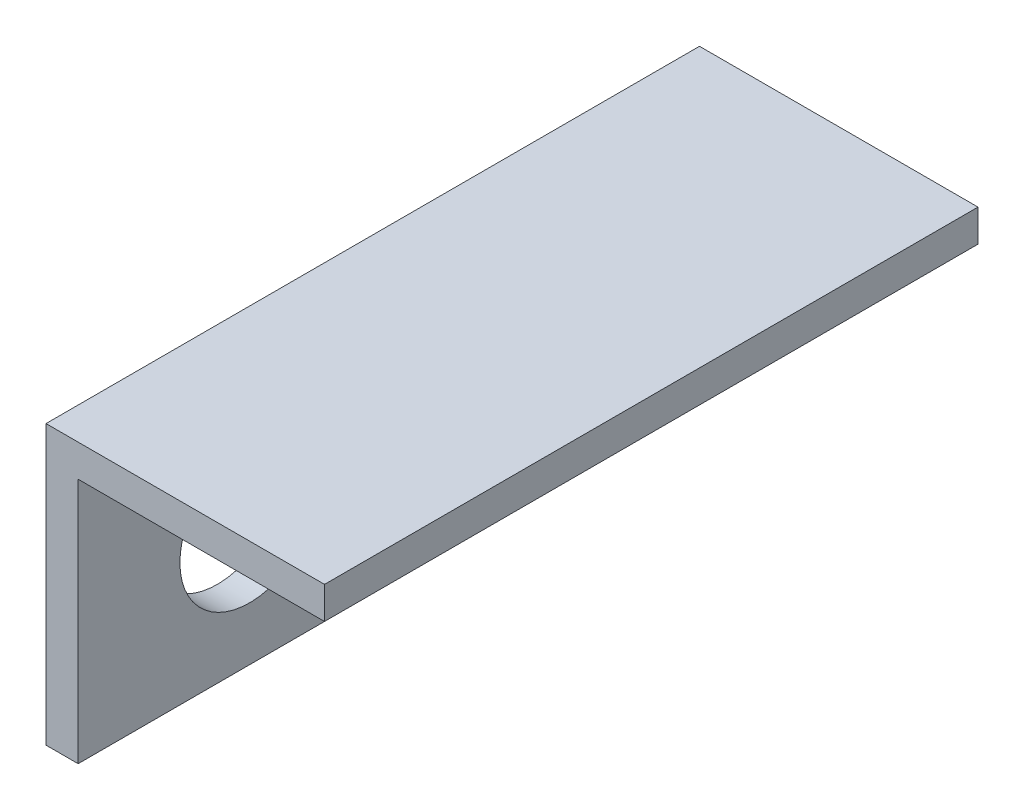
from build123d import *

# Parameters (mm, degrees)
SKETCH1_W           = 61
SKETCH1_H           = 26
BOSS_EXTRUDE1_DEPTH = 3
SKETCH3_W           = 61
SKETCH3_H           = 3
BOSS_EXTRUDE2_DEPTH = 26
SKETCH4_R           = 2.5
SKETCH4_R_2         = 6.5
CUT_EXTRUDE1_DEPTH  = 43.133715716
CUT_EXTRUDE2_DEPTH  = 0.5
CUT_EXTRUDE3_DEPTH  = 0.5
CUT_EXTRUDE4_DEPTH  = 0.5


with BuildPart() as part:
    # Sketch1 → Boss-Extrude1 (new body)
    with BuildSketch(Plane(origin=(0, 0, 0), x_dir=(0, 0, -1), z_dir=(1, 0, 0))):
        Rectangle(SKETCH1_W, SKETCH1_H)
    extrude(amount=BOSS_EXTRUDE1_DEPTH)

    # Sketch3 → Boss-Extrude2 (add)
    with BuildSketch(Plane(origin=(0, 0, 0), x_dir=(0, 0, -1), z_dir=(1, 0, 0))):
        with Locations((0, 11.5)):
            Rectangle(SKETCH3_W, SKETCH3_H)
    extrude(amount=BOSS_EXTRUDE2_DEPTH)

    # Sketch4 → Cut-Extrude1 (cut, through all)
    with BuildSketch(Plane(origin=(0, 0, 0), x_dir=(0, 0, -1), z_dir=(1, 0, 0))):
        with Locations(Location((10.5, -1.5, 0), (0, 0, 180))):
            Circle(SKETCH4_R)
        with Locations(Location((-14.5, -1.5, 0), (0, 0, 180))):
            Circle(SKETCH4_R_2)
    extrude(amount=CUT_EXTRUDE1_DEPTH, mode=Mode.SUBTRACT)

    # Sketch5 → Cut-Extrude2 (cut)
    # profile 1 of 11: a face of its own
    with BuildSketch(Plane.ZY):
        with BuildLine():
            Line((-26.754038151, 6.735917857), (-26.071145523, 6.735917857))
            add(Edge.make_bspline(
                [(-26.071145523, 6.735917857), (-26.037717045, 6.735742107), (-25.972924334, 6.735401459), (-25.878704892, 6.730118328), (-25.790456082, 6.722914658), (-25.70815231, 6.711484565), (-25.631831607, 6.697692788), (-25.56126397, 6.680990972), (-25.496673798, 6.660964358), (-25.419561061, 6.629118077), (-25.3316404, 6.581794909), (-25.236442008, 6.511866344), (-25.155037768, 6.426333881), (-25.084851451, 6.329851225), (-25.029050331, 6.223715453), (-24.988681034, 6.110456265), (-24.963123159, 5.991534523), (-24.960494725, 5.909891345), (-24.959166356, 5.868630197)],
                knots=[0, 0, 0, 0, 1.001505555, 1.941167018, 2.826882275, 3.653841531, 4.429895133, 5.150066043, 5.825578002, 6.45369114, 7.647487171, 8.808567382, 9.977351308, 11.170798116, 12.373658725, 13.556498008, 14.765093433, 16, 16, 16, 16], degree=3))
            add(Edge.make_bspline(
                [(-24.959166356, 5.868630197), (-24.960259575, 5.829977641), (-24.962407852, 5.754021724), (-24.982950611, 5.642927615), (-25.01511128, 5.537176396), (-25.059816529, 5.437154011), (-25.117918525, 5.345120398), (-25.186776844, 5.260333132), (-25.269853646, 5.186382075), (-25.332096886, 5.145039172), (-25.363713632, 5.124038851)],
                knots=[0, 0, 0, 0, 1.044552857, 2.05264487, 3.044412934, 4.028983338, 5.005914585, 5.980388656, 6.974128949, 8, 8, 8, 8], degree=3))
            add(Edge.make_bspline(
                [(-25.363713632, 5.124038851), (-25.323953204, 5.108773852), (-25.247881657, 5.079568128), (-25.143195644, 5.027932664), (-25.053000799, 4.971770553), (-24.976603653, 4.910438703), (-24.911265999, 4.844329892), (-24.854213057, 4.772474778), (-24.805531683, 4.69393602), (-24.763818759, 4.609532485), (-24.731270003, 4.520126016), (-24.706894099, 4.42655524), (-24.69292665, 4.329155685), (-24.690939008, 4.262870306), (-24.689935587, 4.229407441)],
                knots=[0, 0, 0, 0, 1.27268992, 2.434971085, 3.483601985, 4.442670788, 5.356604649, 6.2567628, 7.179492994, 8.113709626, 9.066344395, 10.018646069, 10.999752585, 12, 12, 12, 12], degree=3))
            add(Edge.make_bspline(
                [(-24.689935587, 4.229407441), (-24.690912433, 4.195240569), (-24.692834405, 4.12801629), (-24.707014377, 4.029261156), (-24.731023484, 3.934886209), (-24.76409463, 3.844281027), (-24.807256945, 3.757620892), (-24.859784909, 3.674807628), (-24.922416473, 3.596673298), (-24.992479342, 3.522349674), (-25.071741487, 3.455521887), (-25.157257242, 3.39600618), (-25.250103562, 3.347060118), (-25.348755556, 3.305944097), (-25.454319872, 3.274536898), (-25.566322479, 3.252564324), (-25.684666781, 3.237759287), (-25.765876532, 3.236542083), (-25.807523728, 3.235917857)],
                knots=[0, 0, 0, 0, 0.978564426, 1.925352924, 2.850884081, 3.763762016, 4.682927383, 5.618979971, 6.567305752, 7.547517671, 8.540179244, 9.531824382, 10.526200242, 11.540722885, 12.589160233, 13.674978461, 14.80764778, 16, 16, 16, 16], degree=3))
            Line((-25.807523728, 3.235917857), (-26.754038151, 3.235917857))
            Line((-26.754038151, 3.235917857), (-26.754038151, 6.735917857))
        make_face()
        with BuildLine():
            Line((-26.439935587, 6.376943498), (-26.439935587, 5.255148627))
            Line((-26.439935587, 5.255148627), (-26.228897927, 5.255148627))
            add(Edge.make_bspline(
                [(-26.228897927, 5.255148627), (-26.198049131, 5.25554855), (-26.138442972, 5.256321282), (-26.052123076, 5.258534799), (-25.971998057, 5.264732843), (-25.898206224, 5.270929105), (-25.83086378, 5.281003693), (-25.770119919, 5.292995815), (-25.715021322, 5.305678721), (-25.651481776, 5.327248207), (-25.579408828, 5.359125883), (-25.502575724, 5.408597719), (-25.434841254, 5.467522072), (-25.377644066, 5.535513034), (-25.330832596, 5.61037922), (-25.298318881, 5.6909261), (-25.276271597, 5.775146232), (-25.274280065, 5.832964485), (-25.27326892, 5.862320101)],
                knots=[0, 0, 0, 0, 1.156816544, 2.235205308, 3.236616184, 4.169592532, 5.011045266, 5.787822928, 6.49130361, 7.128639758, 8.301311294, 9.436451833, 10.541879658, 11.654887649, 12.756523258, 13.837046038, 14.901820046, 16, 16, 16, 16], degree=3))
            add(Edge.make_bspline(
                [(-25.27326892, 5.862320101), (-25.2737951, 5.881745872), (-25.27482726, 5.919851645), (-25.283280563, 5.975400999), (-25.297648137, 6.027644751), (-25.316102431, 6.077298862), (-25.341891119, 6.122810712), (-25.372254583, 6.165753907), (-25.408940273, 6.204666026), (-25.450697586, 6.241035524), (-25.498706208, 6.273280052), (-25.5529375, 6.301520815), (-25.614125177, 6.324261592), (-25.681238032, 6.344177744), (-25.75530912, 6.358166038), (-25.835483673, 6.369819426), (-25.922418392, 6.375752168), (-25.982563495, 6.376537531), (-26.013653536, 6.376943498)],
                knots=[0, 0, 0, 0, 0.91205012, 1.789085906, 2.630437955, 3.453916878, 4.269457761, 5.079663411, 5.91843418, 6.774407191, 7.675494373, 8.627863946, 9.638891023, 10.736472738, 11.911756761, 13.175263542, 14.539845004, 16, 16, 16, 16], degree=3))
            Line((-26.013653536, 6.376943498), (-26.439935587, 6.376943498))
        make_face(mode=Mode.SUBTRACT)
        with BuildLine():
            Line((-26.439935587, 4.896174268), (-26.439935587, 3.594892216))
            Line((-26.439935587, 3.594892216), (-25.992619882, 3.594892216))
            add(Edge.make_bspline(
                [(-25.992619882, 3.594892216), (-25.960600956, 3.595275964), (-25.898888697, 3.596015586), (-25.809787467, 3.598430141), (-25.727204363, 3.603922416), (-25.651516228, 3.612568266), (-25.581905775, 3.621946715), (-25.519208072, 3.634557996), (-25.462914879, 3.649006957), (-25.397640571, 3.671341129), (-25.324137063, 3.7060376), (-25.244926206, 3.758351826), (-25.174499988, 3.820675134), (-25.114694729, 3.892806048), (-25.06568174, 3.971237375), (-25.030026285, 4.054382725), (-25.008035428, 4.140868253), (-25.005373259, 4.199834965), (-25.004038151, 4.229407441)],
                knots=[0, 0, 0, 0, 1.160039823, 2.235823828, 3.228722157, 4.157150951, 4.99529583, 5.772374946, 6.472645482, 7.099169577, 8.269452708, 9.405989375, 10.527446681, 11.663510218, 12.788923519, 13.866172445, 14.929861265, 16, 16, 16, 16], degree=3))
            add(Edge.make_bspline(
                [(-25.004038151, 4.229407441), (-25.004314255, 4.247900781), (-25.00486201, 4.284589163), (-25.013122625, 4.338504982), (-25.025136495, 4.390730855), (-25.040667929, 4.441408596), (-25.063287396, 4.489621972), (-25.089693941, 4.536324532), (-25.120655343, 4.581578011), (-25.168899509, 4.638790265), (-25.239071493, 4.704707278), (-25.338778269, 4.76924478), (-25.452150567, 4.821292587), (-25.53437806, 4.843392063), (-25.576854657, 4.854808082)],
                knots=[0, 0, 0, 0, 0.723448775, 1.435228256, 2.130040452, 2.821711965, 3.505591119, 4.210454504, 4.921174351, 5.648778258, 7.137944449, 8.670945889, 10.280296675, 12, 12, 12, 12], degree=3))
            add(Edge.make_bspline(
                [(-25.576854657, 4.854808082), (-25.593883753, 4.858263166), (-25.630806346, 4.8657545), (-25.691013926, 4.873662204), (-25.759749795, 4.880707264), (-25.837172672, 4.885918421), (-25.923380513, 4.891304965), (-26.018557432, 4.893399786), (-26.122314747, 4.895899046), (-26.194307119, 4.89608018), (-26.231702414, 4.896174268)],
                knots=[0, 0, 0, 0, 0.634451884, 1.375622551, 2.216452059, 3.157844607, 4.20941857, 5.370758133, 6.634282058, 8, 8, 8, 8], degree=3))
            Line((-26.231702414, 4.896174268), (-26.439935587, 4.896174268))
        make_face(mode=Mode.SUBTRACT)
    # profile 2 of 11: a face of its own
    with BuildSketch(Plane.ZY):
        Polygon((-22.536089433, 6.735917857), (-20.920704818, 3.235917857), (-21.262151132, 3.235917857), (-21.779579016, 4.357712729), (-23.366217638, 4.357712729), (-23.898369081, 3.235917857), (-24.241217638, 3.235917857), (-22.580961228, 6.735917857), align=None)
        Polygon((-22.56203094, 6.053726351), (-23.195845042, 4.716687088), (-21.94504376, 4.716687088), align=None, mode=Mode.SUBTRACT)
    # profile 3 of 11: a face of its own
    with BuildSketch(Plane.ZY):
        Polygon((-20.696345843, 6.376943498), (-20.696345843, 6.735917857), (-18.856602254, 6.735917857), (-18.856602254, 6.376943498), (-19.619422766, 6.376943498), (-19.619422766, 3.235917857), (-19.933525331, 3.235917857), (-19.933525331, 6.376943498), align=None)
    # profile 4 of 11: a face of its own
    with BuildSketch(Plane.ZY):
        Polygon((-18.721986869, 6.376943498), (-18.721986869, 6.735917857), (-16.882243279, 6.735917857), (-16.882243279, 6.376943498), (-17.645063792, 6.376943498), (-17.645063792, 3.235917857), (-17.959166356, 3.235917857), (-17.959166356, 6.376943498), align=None)
    # profile 5 of 11: a face of its own
    with BuildSketch(Plane.ZY):
        with BuildLine():
            add(Edge.make_bspline(
                [(-25.116217638, -0.007671886), (-25.051409532, -0.009313366), (-24.924121065, -0.012537367), (-24.737046168, -0.03721647), (-24.558451072, -0.07991186), (-24.386880934, -0.136774843), (-24.224387957, -0.212629228), (-24.069749065, -0.304314376), (-23.923332191, -0.412790835), (-23.787110809, -0.537220062), (-23.662453859, -0.672603516), (-23.552627973, -0.817081426), (-23.460585679, -0.969780228), (-23.384999892, -1.130241059), (-23.325701282, -1.298101027), (-23.284782238, -1.47425503), (-23.258644088, -1.65756172), (-23.255588311, -1.782588584), (-23.254038151, -1.846013232)],
                knots=[0, 0, 0, 0, 1.065120563, 2.091984664, 3.0946048, 4.079830382, 5.057816894, 6.036188127, 7.030412546, 8.04752943, 9.064399622, 10.05169764, 11.02544977, 11.989514704, 12.962713494, 13.945757189, 14.957906945, 16, 16, 16, 16], degree=3))
            add(Edge.make_bspline(
                [(-23.254038151, -1.846013232), (-23.255588084, -1.908970679), (-23.25864318, -2.033067099), (-23.284811958, -2.215210543), (-23.325852958, -2.39030124), (-23.384449224, -2.558046893), (-23.459674702, -2.718624456), (-23.552329873, -2.87161141), (-23.661471084, -3.017057909), (-23.785677935, -3.153370574), (-23.921078977, -3.278368045), (-24.066309244, -3.38728692), (-24.218102564, -3.481011045), (-24.378412272, -3.555794719), (-24.545112309, -3.615566639), (-24.719694632, -3.656319269), (-24.901341186, -3.682606313), (-25.02521219, -3.685624829), (-25.088172766, -3.687159066)],
                knots=[0, 0, 0, 0, 1.043624062, 2.057103931, 3.04512605, 4.022047818, 4.998200453, 5.980619268, 6.982898556, 8.009068085, 9.034988726, 10.034168286, 11.015286542, 11.987931943, 12.962482838, 13.94673481, 14.956375938, 16, 16, 16, 16], degree=3))
            add(Edge.make_bspline(
                [(-25.088172766, -3.687159066), (-25.151597085, -3.685609679), (-25.276623301, -3.682555425), (-25.460160337, -3.65637402), (-25.636438081, -3.615432716), (-25.804952432, -3.55692328), (-25.965797361, -3.481306049), (-26.119287444, -3.38910167), (-26.264806591, -3.279694529), (-26.401148338, -3.155527955), (-26.525897536, -3.020356403), (-26.634656912, -2.875522147), (-26.726882025, -2.723866691), (-26.802245358, -2.564969167), (-26.861909817, -2.399597724), (-26.902614635, -2.226649247), (-26.928950587, -2.047109741), (-26.931985434, -1.924866842), (-26.933525331, -1.862840155)],
                knots=[0, 0, 0, 0, 1.053102029, 2.075944431, 3.073151272, 4.055350789, 5.033113405, 6.020478099, 7.024410459, 8.052272461, 9.079885166, 10.07527673, 11.055994387, 12.023226415, 12.992069828, 13.970394897, 14.97016774, 16, 16, 16, 16], degree=3))
            add(Edge.make_bspline(
                [(-26.933525331, -1.862840155), (-26.932990695, -1.821207486), (-26.931928169, -1.738467363), (-26.919136476, -1.615600763), (-26.900574775, -1.494710105), (-26.873972862, -1.376139157), (-26.839181195, -1.260178172), (-26.798129168, -1.146027409), (-26.747989323, -1.034843686), (-26.691308675, -0.926100294), (-26.628046867, -0.821492388), (-26.558171117, -0.722612805), (-26.484135749, -0.628631808), (-26.402972355, -0.541984804), (-26.31735591, -0.460151148), (-26.225897532, -0.384388431), (-26.129155287, -0.31401348), (-26.026712908, -0.250593139), (-25.921094633, -0.193234004), (-25.812217855, -0.144012153), (-25.701561284, -0.101766092), (-25.588606636, -0.067525267), (-25.473653863, -0.040493231), (-25.356452079, -0.022085877), (-25.237094653, -0.009261559), (-25.156683334, -0.008204057), (-25.116217638, -0.007671886)],
                knots=[0, 0, 0, 0, 1.037015668, 2.060948919, 3.074880161, 4.083647147, 5.086022904, 6.090072063, 7.104153813, 8.122640571, 9.144368836, 10.147691507, 11.138137339, 12.123020368, 13.103399296, 14.087645067, 15.080126199, 16.082011238, 17.087798457, 18.072939717, 19.057185487, 20.037253025, 21.01195951, 21.997135196, 22.992090687, 24, 24, 24, 24], degree=3))
        make_face()
        with BuildLine():
            add(Edge.make_bspline(
                [(-25.100792959, -0.366646245), (-25.134007592, -0.367051135), (-25.200119325, -0.367857045), (-25.298403861, -0.378472761), (-25.395395795, -0.39360265), (-25.491115157, -0.415184171), (-25.585161447, -0.444588223), (-25.678411288, -0.478429131), (-25.770014342, -0.519650222), (-25.8596682, -0.566222926), (-25.946583275, -0.617771847), (-26.028595976, -0.674743614), (-26.10591862, -0.735802169), (-26.178361887, -0.801090006), (-26.245713059, -0.870939608), (-26.309297761, -0.944292044), (-26.366567342, -1.023243935), (-26.419052919, -1.105654342), (-26.466020759, -1.191415923), (-26.507786114, -1.279625785), (-26.541950123, -1.371003472), (-26.569812499, -1.46455763), (-26.59291231, -1.560140089), (-26.607546234, -1.658475938), (-26.618278594, -1.75907105), (-26.619038439, -1.827052904), (-26.619422766, -1.861437912)],
                knots=[0, 0, 0, 0, 1.008559885, 2.007477868, 2.99961109, 3.989939068, 4.984837346, 5.991145699, 7.001802488, 8.033829008, 9.059044045, 10.069351652, 11.065060232, 12.050310815, 13.029377138, 14.011219647, 14.996725999, 15.989392538, 16.977580475, 17.965360261, 18.951710183, 19.937753436, 20.929683414, 21.935841486, 22.955955122, 24, 24, 24, 24], degree=3))
            add(Edge.make_bspline(
                [(-26.619422766, -1.861437912), (-26.618147904, -1.912000133), (-26.615639857, -2.011471663), (-26.593682287, -2.157239807), (-26.559860312, -2.297328093), (-26.510002946, -2.430970002), (-26.447652331, -2.559314285), (-26.370625441, -2.68122239), (-26.279366355, -2.796727264), (-26.175702829, -2.905022533), (-26.062380122, -3.003868338), (-25.942047392, -3.090631746), (-25.815993784, -3.164041996), (-25.683890582, -3.223847068), (-25.546443043, -3.271236806), (-25.402765492, -3.303715437), (-25.253815032, -3.325090893), (-25.152284377, -3.327143649), (-25.100792959, -3.328184707)],
                knots=[0, 0, 0, 0, 1.032063989, 2.030389145, 3.003944642, 3.970395727, 4.937377036, 5.913328081, 6.909231446, 7.93887556, 8.970685674, 9.976071282, 10.964166581, 11.944589148, 12.933237628, 13.927779006, 14.949070134, 16, 16, 16, 16], degree=3))
            add(Edge.make_bspline(
                [(-25.100792959, -3.328184707), (-25.066183457, -3.327709202), (-24.997542421, -3.326766134), (-24.895446898, -3.317267458), (-24.795190687, -3.302035588), (-24.696914407, -3.280104933), (-24.600729595, -3.252657726), (-24.506234792, -3.220049998), (-24.414436502, -3.179368794), (-24.324176664, -3.134420843), (-24.237780422, -3.083180685), (-24.15530489, -3.028142536), (-24.07882891, -2.967173915), (-24.006439839, -2.902856102), (-23.93881215, -2.833892255), (-23.876403166, -2.760372033), (-23.819423034, -2.681831376), (-23.766957387, -2.59954597), (-23.720154124, -2.513549717), (-23.679375025, -2.425020039), (-23.644778909, -2.33417493), (-23.616850404, -2.240883358), (-23.594964943, -2.14532251), (-23.579885023, -2.047364431), (-23.569336584, -1.947205089), (-23.568541507, -1.879461233), (-23.568140715, -1.845312111)],
                knots=[0, 0, 0, 0, 1.047197238, 2.076906641, 3.100256066, 4.114471768, 5.12198147, 6.126382909, 7.136867548, 8.15857795, 9.17633901, 10.174870724, 11.156907918, 12.133735059, 13.104061851, 14.077631395, 15.04955518, 16.038496417, 17.029181396, 18.010275684, 18.986308667, 19.968651475, 20.955262928, 21.950658345, 22.966943676, 24, 24, 24, 24], degree=3))
            add(Edge.make_bspline(
                [(-23.568140715, -1.845312111), (-23.568541828, -1.811396606), (-23.56933751, -1.744118956), (-23.579879984, -1.644658138), (-23.594980875, -1.547404926), (-23.616743583, -1.452741123), (-23.644793736, -1.360642598), (-23.679381067, -1.271195851), (-23.720166366, -1.184067655), (-23.766974591, -1.099473358), (-23.819590414, -1.01829862), (-23.877084657, -0.940696208), (-23.940450006, -0.868123467), (-24.00787603, -0.798788773), (-24.081046916, -0.734170883), (-24.15963121, -0.674248362), (-24.242674888, -0.617575088), (-24.330602123, -0.566449526), (-24.421346077, -0.519235294), (-24.514460035, -0.47878429), (-24.608889134, -0.444412171), (-24.704393247, -0.415095206), (-24.801776225, -0.393687176), (-24.900380054, -0.378459126), (-25.000068312, -0.36786074), (-25.067111532, -0.367052361), (-25.100792959, -0.366646245)],
                knots=[0, 0, 0, 0, 1.02996197, 2.043119294, 3.035359645, 4.018872909, 4.991431989, 5.957985074, 6.929999688, 7.912076566, 8.892894881, 9.867085534, 10.843653904, 11.817741046, 12.803660682, 13.806313499, 14.818574707, 15.856120519, 16.894564902, 17.924820532, 18.937903209, 19.946497019, 20.957711757, 21.963978472, 22.977135795, 24, 24, 24, 24], degree=3))
        make_face(mode=Mode.SUBTRACT)
    # profile 6 of 11: a face of its own
    with BuildSketch(Plane.ZY):
        Polygon((-22.536089433, -0.097415476), (-20.830961228, -0.097415476), (-20.830961228, -0.456389835), (-22.221986869, -0.456389835), (-22.221986869, -1.533312912), (-20.830961228, -1.533312912), (-20.830961228, -1.892287271), (-22.221986869, -1.892287271), (-22.221986869, -3.597415476), (-22.536089433, -3.597415476), align=None)
    # profile 7 of 11: a face of its own
    with BuildSketch(Plane.ZY):
        Polygon((-20.2027561, -0.097415476), (-18.497627895, -0.097415476), (-18.497627895, -0.456389835), (-19.888653536, -0.456389835), (-19.888653536, -1.533312912), (-18.497627895, -1.533312912), (-18.497627895, -1.892287271), (-19.888653536, -1.892287271), (-19.888653536, -3.597415476), (-20.2027561, -3.597415476), align=None)
    # profile 8 of 11: a face of its own
    with BuildSketch(Plane.ZY):
        Polygon((-26.978397125, -6.930748809), (-26.653777734, -6.930748809), (-25.968781741, -9.4975557), (-24.950051773, -6.930748809), (-24.904478856, -6.930748809), (-23.904679177, -9.480027655), (-23.216177574, -6.930748809), (-22.895063792, -6.930748809), (-23.838773728, -10.430748809), (-23.883645523, -10.430748809), (-24.936730459, -7.753865797), (-26.002435587, -10.430748809), (-26.047307382, -10.430748809), align=None)
    # profile 9 of 11: a face of its own
    with BuildSketch(Plane.ZY):
        Polygon((-20.830961228, -6.930748809), (-19.215576613, -10.430748809), (-19.557022927, -10.430748809), (-20.074450811, -9.308953938), (-21.661089433, -9.308953938), (-22.193240875, -10.430748809), (-22.536089433, -10.430748809), (-20.875833023, -6.930748809), align=None)
        Polygon((-20.856902734, -7.612940316), (-21.490716837, -8.949979579), (-20.239915555, -8.949979579), align=None, mode=Mode.SUBTRACT)
    # profile 10 of 11: a face of its own
    with BuildSketch(Plane.ZY):
        Polygon((-18.587371484, -6.930748809), (-18.27326892, -6.930748809), (-18.27326892, -10.07177445), (-16.927115074, -10.07177445), (-16.927115074, -10.430748809), (-18.587371484, -10.430748809), align=None)
    # profile 11 of 11: a face of its own
    with BuildSketch(Plane.ZY):
        Polygon((-16.343781741, -6.930748809), (-16.029679177, -6.930748809), (-16.029679177, -10.07177445), (-14.683525331, -10.07177445), (-14.683525331, -10.430748809), (-16.343781741, -10.430748809), align=None)
    extrude(amount=-CUT_EXTRUDE2_DEPTH, mode=Mode.SUBTRACT)

    # Sketch6 → Cut-Extrude3 (cut)
    with BuildSketch(Plane(origin=(0, 0, 0), x_dir=(0, 0, -1), z_dir=(1, 0, 0))):
        with BuildLine():
            add(Edge.make_bspline(
                [(-4.036519524, -1.3812026), (-4.036191506, -1.325105212), (-4.035554326, -1.216135228), (-4.028465905, -1.057350586), (-4.016690562, -0.908390297), (-4.00055319, -0.769247231), (-3.980915209, -0.639885466), (-3.954699723, -0.520650709), (-3.92488692, -0.410991103), (-3.890334474, -0.310549054), (-3.851346685, -0.217971351), (-3.808912425, -0.13154615), (-3.76134763, -0.051404218), (-3.711370717, 0.023733573), (-3.656958646, 0.092637268), (-3.599659855, 0.15627993), (-3.537237979, 0.213190681), (-3.471814971, 0.265036983), (-3.402798506, 0.310486455), (-3.33215584, 0.350519193), (-3.259400734, 0.384719061), (-3.184334551, 0.411609496), (-3.107631993, 0.433820343), (-3.029024927, 0.449009291), (-2.948383563, 0.458566199), (-2.893952128, 0.459479867), (-2.866347248, 0.459943233)],
                knots=[0, 0, 0, 0, 1.646270934, 3.197905019, 4.663502075, 6.030701355, 7.308322542, 8.50163776, 9.611534131, 10.641858119, 11.616356847, 12.558055219, 13.465016945, 14.349605745, 15.204443733, 16.039544428, 16.859896111, 17.680448484, 18.487036065, 19.28249412, 20.06191084, 20.843045899, 21.620316918, 22.403196591, 23.190181807, 24, 24, 24, 24], degree=3))
            add(Edge.make_bspline(
                [(-2.866347248, 0.459943233), (-2.83851177, 0.459455418), (-2.783155761, 0.458485307), (-2.701315386, 0.449161365), (-2.621365704, 0.433690242), (-2.543647565, 0.411769267), (-2.467522579, 0.38457359), (-2.393586171, 0.350486473), (-2.321379089, 0.310807606), (-2.252048802, 0.264183729), (-2.184834186, 0.212201452), (-2.121386223, 0.153438784), (-2.061699138, 0.088489064), (-2.005023832, 0.0180472), (-1.952968235, -0.059237884), (-1.903394803, -0.142021994), (-1.859022767, -0.231752859), (-1.816288092, -0.326933327), (-1.779401105, -0.430196986), (-1.74613486, -0.540961746), (-1.719255891, -0.660535933), (-1.696866619, -0.788292178), (-1.679521723, -0.924699662), (-1.666889081, -1.069465977), (-1.660215996, -1.222686368), (-1.658959294, -1.327444217), (-1.658314396, -1.3812026)],
                knots=[0, 0, 0, 0, 0.810914788, 1.612654377, 2.396697861, 3.181598691, 3.963628158, 4.749916497, 5.551656086, 6.361998678, 7.18212741, 8.025565596, 8.878627764, 9.750805457, 10.657531673, 11.591944965, 12.560506719, 13.57287815, 14.630710178, 15.753379473, 16.941251878, 18.199788006, 19.531962791, 20.947069417, 22.433333509, 24, 24, 24, 24], degree=3))
            add(Edge.make_bspline(
                [(-1.658314396, -1.3812026), (-1.65896598, -1.434726508), (-1.660235566, -1.53901566), (-1.666814273, -1.691546635), (-1.679772904, -1.835544678), (-1.695982892, -1.971355141), (-1.718433855, -2.09841276), (-1.746039021, -2.217157208), (-1.776689344, -2.32810128), (-1.814524138, -2.430336091), (-1.855934849, -2.525287814), (-1.900990045, -2.613954963), (-1.949259871, -2.697121255), (-2.001848616, -2.774121002), (-2.057902029, -2.845499659), (-2.118619818, -2.909997282), (-2.182290403, -2.969167954), (-2.249702819, -3.021819581), (-2.32011437, -3.067904386), (-2.392073447, -3.109118236), (-2.46685683, -3.142350931), (-2.542769783, -3.170885972), (-2.620898149, -3.192686424), (-2.70114454, -3.20776028), (-2.783100776, -3.218332128), (-2.838502341, -3.219138608), (-2.866347248, -3.219543946)],
                knots=[0, 0, 0, 0, 1.561518951, 3.042555995, 4.452378317, 5.7783523, 7.031515105, 8.214008947, 9.334062868, 10.386615937, 11.391082383, 12.354592575, 13.286541444, 14.194233754, 15.072674879, 15.931287219, 16.775624067, 17.606195743, 18.42308326, 19.229000347, 20.022332153, 20.807536673, 21.593273796, 22.3848459, 23.188221202, 24, 24, 24, 24], degree=3))
            add(Edge.make_bspline(
                [(-2.866347248, -3.219543946), (-2.893951362, -3.219077591), (-2.948381287, -3.218158029), (-3.029033712, -3.208644297), (-3.107316156, -3.193348794), (-3.18361491, -3.17193219), (-3.258321425, -3.145717354), (-3.330417712, -3.11156367), (-3.400705395, -3.072229601), (-3.468996951, -3.02743418), (-3.534009112, -2.976112497), (-3.596107718, -2.919348208), (-3.653732737, -2.855724797), (-3.707366832, -2.786246873), (-3.758340921, -2.711553631), (-3.805230294, -2.630625258), (-3.848601148, -2.543782648), (-3.888244639, -2.450464737), (-3.923393302, -2.349309809), (-3.95444101, -2.239160631), (-3.978955168, -2.119044994), (-3.999938123, -1.989927627), (-4.016862506, -1.851253697), (-4.028416831, -1.702947919), (-4.035558146, -1.54510271), (-4.036193217, -1.436832936), (-4.036519524, -1.3812026)],
                knots=[0, 0, 0, 0, 0.810891512, 1.598919785, 2.382837074, 3.152667961, 3.926044502, 4.706494248, 5.493654104, 6.291793342, 7.103789334, 7.925228297, 8.761435821, 9.622817696, 10.50288917, 11.416980706, 12.369136599, 13.353924996, 14.394355917, 15.514179734, 16.714354668, 17.994756427, 19.357759367, 20.818452758, 22.365282078, 24, 24, 24, 24], degree=3))
        make_face()
        with BuildLine():
            add(Edge.make_bspline(
                [(-3.72241696, -1.379800356), (-3.722297513, -1.426549055), (-3.722065689, -1.5172791), (-3.716009489, -1.649122361), (-3.707759257, -1.77209269), (-3.69711796, -1.886346226), (-3.681315011, -1.991496239), (-3.663608223, -2.088265922), (-3.642060134, -2.176143159), (-3.616565116, -2.25573097), (-3.587526019, -2.328380038), (-3.555820155, -2.395981253), (-3.521759432, -2.45933319), (-3.483640282, -2.517866798), (-3.442125218, -2.571772962), (-3.398151959, -2.622005795), (-3.350079375, -2.666802776), (-3.283575633, -2.720529631), (-3.195779158, -2.776048765), (-3.085158703, -2.824394854), (-2.971490252, -2.854777311), (-2.894339002, -2.858641067), (-2.855830421, -2.860569587)],
                knots=[0, 0, 0, 0, 1.459021318, 2.831673884, 4.118529203, 5.306027144, 6.411944654, 7.436330062, 8.375795394, 9.233974572, 10.042671642, 10.816086306, 11.563610507, 12.285937304, 12.993564865, 13.685989202, 14.367179055, 15.041617293, 16.353048772, 17.594441528, 18.799311195, 20, 20, 20, 20], degree=3))
            add(Edge.make_bspline(
                [(-2.855830421, -2.860569587), (-2.81707275, -2.858971806), (-2.739637426, -2.855779544), (-2.626503631, -2.824980806), (-2.516673361, -2.778511267), (-2.430601421, -2.723563761), (-2.365118877, -2.671235432), (-2.318201887, -2.626620784), (-2.275139839, -2.576664916), (-2.234297764, -2.52276562), (-2.196838688, -2.463893136), (-2.162775551, -2.400330561), (-2.131692203, -2.331901383), (-2.113983157, -2.284131644), (-2.104928979, -2.259708209)],
                knots=[0, 0, 0, 0, 1.353760809, 2.704726607, 4.075137775, 5.516104923, 6.260822281, 7.007110065, 7.778089737, 8.566572457, 9.372053459, 10.217411131, 11.088608312, 12, 12, 12, 12], degree=3))
            add(Edge.make_bspline(
                [(-2.104928979, -2.259708209), (-2.094377211, -2.22847847), (-2.072952597, -2.165068705), (-2.045340823, -2.066705053), (-2.023595424, -1.963502289), (-2.004032058, -1.856077173), (-1.990679002, -1.743637472), (-1.979931189, -1.626531088), (-1.973600502, -1.504669725), (-1.972815751, -1.421874734), (-1.97241696, -1.379800356)],
                knots=[0, 0, 0, 0, 0.884706709, 1.796334032, 2.740027952, 3.714592787, 4.726048262, 5.777819803, 6.87074269, 8, 8, 8, 8], degree=3))
            add(Edge.make_bspline(
                [(-1.97241696, -1.379800356), (-1.972967149, -1.337732784), (-1.974043437, -1.255439619), (-1.978157424, -1.134921438), (-1.988780999, -1.020453678), (-2.000580118, -0.911543205), (-2.017977339, -0.808792902), (-2.036735146, -0.711342597), (-2.061936358, -0.620399572), (-2.088856133, -0.53453999), (-2.119666528, -0.454739336), (-2.153582263, -0.38062555), (-2.189804022, -0.311840825), (-2.229146262, -0.248573883), (-2.271141945, -0.19054134), (-2.316899494, -0.138906746), (-2.364603867, -0.092069778), (-2.431421053, -0.038607209), (-2.518895343, 0.015904487), (-2.62774099, 0.066070247), (-2.741011634, 0.094878539), (-2.817585088, 0.098940226), (-2.855830421, 0.100968874)],
                knots=[0, 0, 0, 0, 1.31362396, 2.569729283, 3.763502607, 4.902122613, 5.988968491, 7.01645872, 7.998833611, 8.933434873, 9.825090667, 10.667526885, 11.477055099, 12.250526234, 12.991942729, 13.710640831, 14.402115721, 15.076753259, 16.378508321, 17.609869233, 18.806226677, 20, 20, 20, 20], degree=3))
            add(Edge.make_bspline(
                [(-2.855830421, 0.100968874), (-2.894541013, 0.098937428), (-2.972032719, 0.094870834), (-3.086480674, 0.06617758), (-3.196185025, 0.016164614), (-3.283428, -0.038787758), (-3.350291786, -0.09112607), (-3.39737448, -0.136512524), (-3.441520652, -0.186158778), (-3.482188352, -0.240560693), (-3.520277635, -0.29902606), (-3.555258648, -0.362014825), (-3.586775978, -0.429846189), (-3.615860514, -0.502462625), (-3.641433302, -0.582043569), (-3.662527265, -0.669812563), (-3.682014318, -0.766274455), (-3.695809587, -0.871993963), (-3.708073343, -0.986276116), (-3.715954691, -1.109553434), (-3.722085948, -1.241617815), (-3.722304413, -1.332816973), (-3.72241696, -1.379800356)],
                knots=[0, 0, 0, 0, 1.207732386, 2.417664972, 3.655092373, 4.956220595, 5.625982001, 6.301752483, 6.994047911, 7.697131622, 8.419323945, 9.170223765, 9.943494443, 10.752040957, 11.610060368, 12.549350801, 13.567764191, 14.679664412, 15.874934091, 17.154273443, 18.533957287, 20, 20, 20, 20], degree=3))
        make_face(mode=Mode.SUBTRACT)
    extrude(amount=CUT_EXTRUDE3_DEPTH, mode=Mode.SUBTRACT)

    # Sketch7 → Cut-Extrude4 (cut)
    with BuildSketch(Plane(origin=(0, 0, 0), x_dir=(0, 0, -1), z_dir=(1, 0, 0))):
        Polygon((-23.834610268, 0.059644615), (-24.481745685, 0.059644615), (-24.481745685, -3.440355385), (-24.167643121, -3.440355385), (-24.167643121, -0.299329744), (-23.629181583, -0.299329744), align=None)
    extrude(amount=CUT_EXTRUDE4_DEPTH, mode=Mode.SUBTRACT)


solid = part.part
